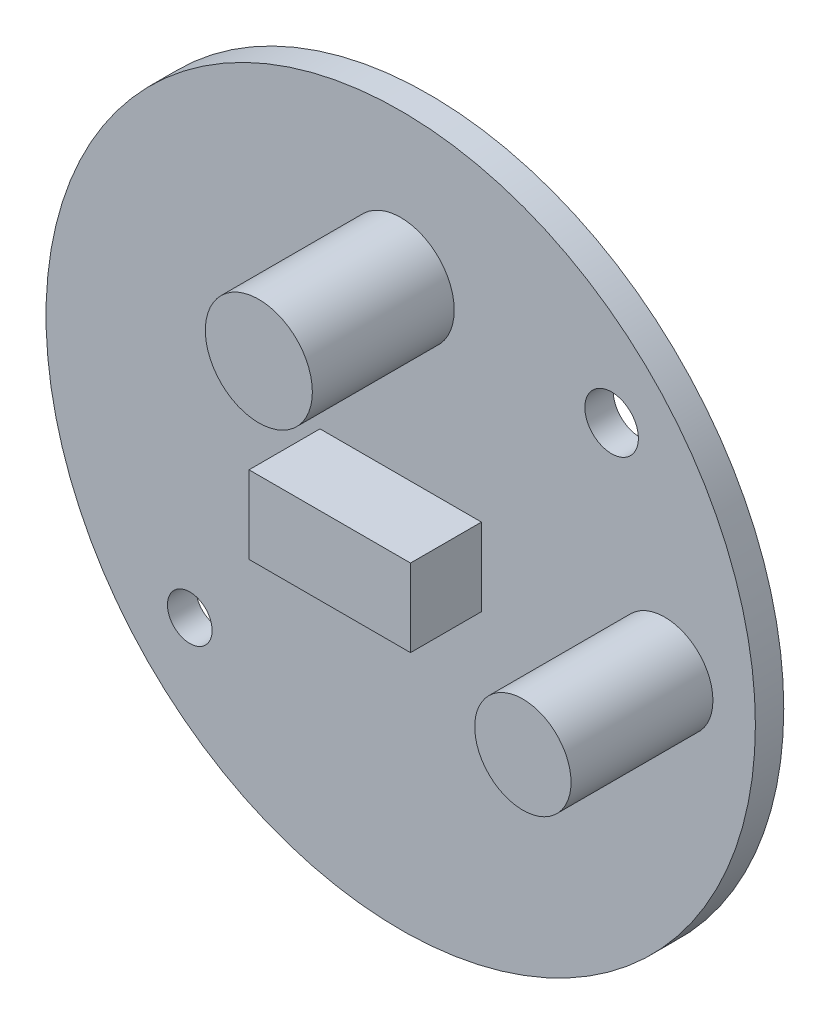
from build123d import *

# Parameters (mm, degrees)
SKETCH1_R           = 25
BOSS_EXTRUDE1_DEPTH = 2
SKETCH2_R           = 3.772478216
SKETCH2_R_2         = 3.395230394
BOSS_EXTRUDE2_DEPTH = 10
SKETCH3_W           = 11.380817266
SKETCH3_H           = 5.470093412
BOSS_EXTRUDE3_DEPTH = 5
SKETCH4_R           = 1.574884911
SKETCH4_R_2         = 1.887966751
CUT_EXTRUDE1_DEPTH  = 5


with BuildPart() as part:
    # Sketch1 → Boss-Extrude1 (new body)
    with BuildSketch(Plane.XY):
        Circle(SKETCH1_R)
    extrude(amount=BOSS_EXTRUDE1_DEPTH)

    # Sketch2 → Boss-Extrude2 (add)
    with BuildSketch(Plane.XY.offset(2)):
        with Locations((0, 14.712665041)):
            Circle(SKETCH2_R)
        with Locations((18.611146521, 0)):
            Circle(SKETCH2_R_2)
    extrude(amount=BOSS_EXTRUDE2_DEPTH)

    # Sketch3 → Boss-Extrude3 (add)
    with BuildSketch(Plane.XY.offset(2)):
        Rectangle(SKETCH3_W, SKETCH3_H)
    extrude(amount=BOSS_EXTRUDE3_DEPTH)

    # Sketch4 → Cut-Extrude1 (cut)
    with BuildSketch(Plane.XY.offset(2)):
        with Locations((-14.865882925, -13.379294632)):
            Circle(SKETCH4_R)
        with Locations((14.865882925, 13.379294632)):
            Circle(SKETCH4_R_2)
    extrude(amount=-CUT_EXTRUDE1_DEPTH, mode=Mode.SUBTRACT)


solid = part.part
